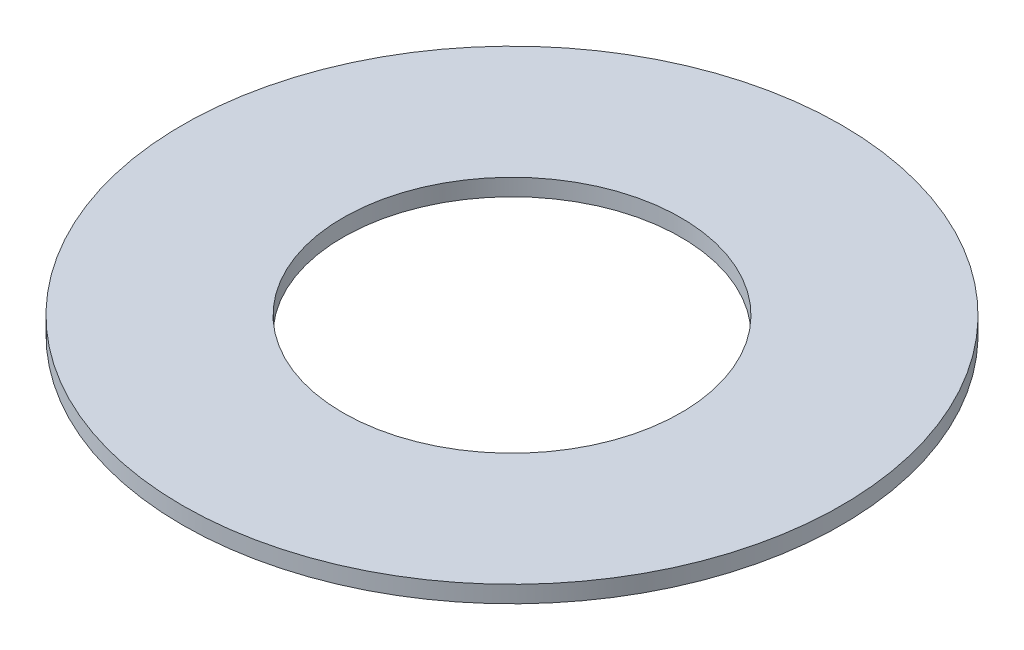
from build123d import *

# Parameters (mm, degrees)
SKETCH1_R           = 9.75
SKETCH1_R_2         = 5
BOSS_EXTRUDE1_DEPTH = 0.5


with BuildPart() as part:
    # Sketch1 → Boss-Extrude1 (new body)
    with BuildSketch(Plane(origin=(0, 0, 0), x_dir=(1, 0, 0), z_dir=(0, 1, 0))):
        with Locations(Location((0, 0, 0), (0, 0, 270))):
            Circle(SKETCH1_R)
        with Locations(Location((0, 0, 0), (0, 0, 270))):
            Circle(SKETCH1_R_2, mode=Mode.SUBTRACT)
    extrude(amount=BOSS_EXTRUDE1_DEPTH)


solid = part.part
